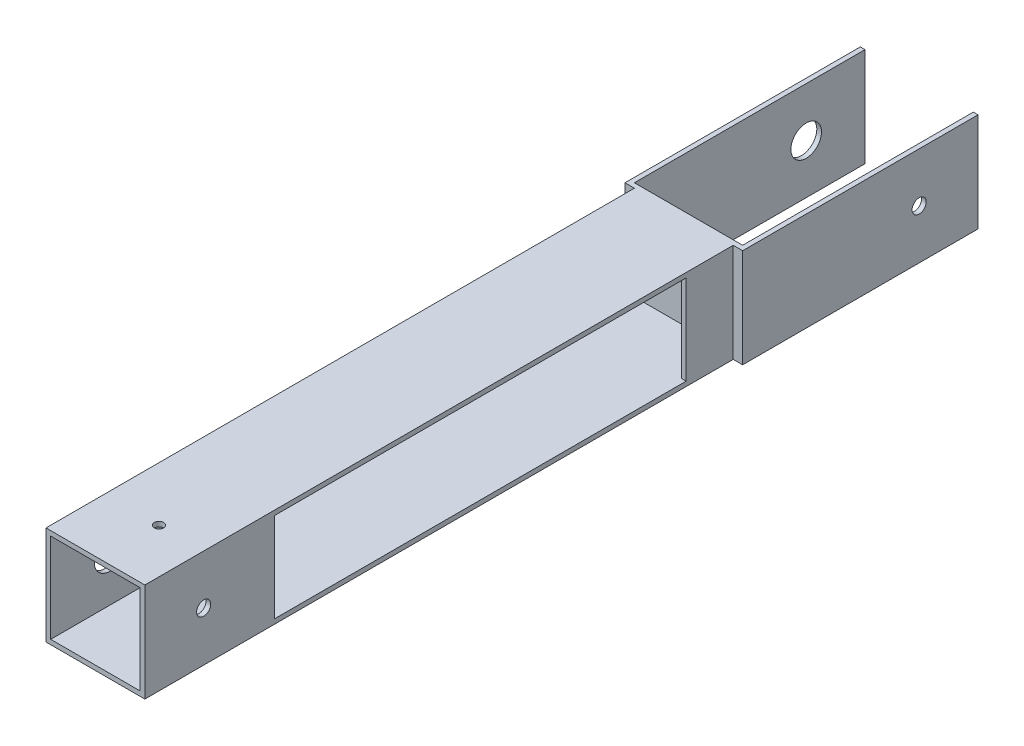
from build123d import *

# Parameters (mm, degrees)
SKETCH1_W           = 42
SKETCH1_H           = 42
SKETCH1_W_2         = 38
SKETCH1_H_2         = 38
BOSS_EXTRUDE1_DEPTH = 250
BOSS_EXTRUDE2_DEPTH = 21
CUT_EXTRUDE1_REACH  = 356.177
SKETCH3_R           = 6.5
CUT_EXTRUDE2_REACH  = 356.177
SKETCH4_R           = 3
SKETCH5_W           = 175
SKETCH5_H           = 38
CUT_EXTRUDE3_DEPTH  = 10
SKETCH6_R           = 2
CUT_EXTRUDE4_DEPTH  = 354.396378023


with BuildPart() as part:
    # Sketch1 → Boss-Extrude1 (new body)
    with BuildSketch(Plane.XY):
        Rectangle(SKETCH1_W, SKETCH1_H)
        Rectangle(SKETCH1_W_2, SKETCH1_H_2, mode=Mode.SUBTRACT)
    extrude(amount=-BOSS_EXTRUDE1_DEPTH)

    # Sketch2 → Boss-Extrude2 (add, symmetric)
    with BuildSketch(Plane(origin=(0, 0, 0), x_dir=(1, 0, 0), z_dir=(0, 1, 0))):
        Polygon((-25, 250), (-25, 350), (-23, 350), (-23, 252), (23, 252), (23, 350), (25, 350), (25, 250), align=None)
    extrude(amount=BOSS_EXTRUDE2_DEPTH, both=True)

    # Sketch3 → Cut-Extrude1 (cut, up to next)
    with BuildSketch(Plane.ZY.offset(25), mode=Mode.PRIVATE) as cut_extrude1_sk1:
        with Locations((-25, 0)):
            Circle(SKETCH3_R)
    cut_extrude1_tool1 = extrude(cut_extrude1_sk1.sketch, amount=-CUT_EXTRUDE1_REACH, mode=Mode.PRIVATE) & part.part
    # Sketch3 → Cut-Extrude1 (cut, up to next)
    with BuildSketch(Plane.ZY.offset(25), mode=Mode.PRIVATE) as cut_extrude1_sk2:
        with Locations((-325, 0)):
            Circle(SKETCH3_R)
    cut_extrude1_tool2 = extrude(cut_extrude1_sk2.sketch, amount=-CUT_EXTRUDE1_REACH, mode=Mode.PRIVATE) & part.part
    add(cut_extrude1_tool1.solids().sort_by_distance((-25, 0, -25))[0], mode=Mode.SUBTRACT)
    add(cut_extrude1_tool2.solids().sort_by_distance((-25, 0, -325))[0], mode=Mode.SUBTRACT)

    # Sketch4 → Cut-Extrude2 (cut, up to next)
    with BuildSketch(Plane(origin=(25, 0, 0), x_dir=(0, 0, -1), z_dir=(1, 0, 0)), mode=Mode.PRIVATE) as cut_extrude2_sk1:
        with Locations((325, 0)):
            Circle(SKETCH4_R)
    cut_extrude2_tool1 = extrude(cut_extrude2_sk1.sketch, amount=-CUT_EXTRUDE2_REACH, mode=Mode.PRIVATE) & part.part
    # Sketch4 → Cut-Extrude2 (cut, up to next)
    with BuildSketch(Plane(origin=(25, 0, 0), x_dir=(0, 0, -1), z_dir=(1, 0, 0)), mode=Mode.PRIVATE) as cut_extrude2_sk2:
        with Locations((25, 0)):
            Circle(SKETCH4_R)
    cut_extrude2_tool2 = extrude(cut_extrude2_sk2.sketch, amount=-CUT_EXTRUDE2_REACH, mode=Mode.PRIVATE) & part.part
    add(cut_extrude2_tool1.solids().sort_by_distance((25, 0, -325))[0], mode=Mode.SUBTRACT)
    add(cut_extrude2_tool2.solids().sort_by_distance((25, 0, -25))[0], mode=Mode.SUBTRACT)

    # Sketch5 → Cut-Extrude3 (cut)
    with BuildSketch(Plane(origin=(21, 0, 0), x_dir=(0, 0, -1), z_dir=(1, 0, 0))):
        with Locations((142.5, 0)):
            Rectangle(SKETCH5_W, SKETCH5_H)
    extrude(amount=-CUT_EXTRUDE3_DEPTH, mode=Mode.SUBTRACT)

    # Sketch6 → Cut-Extrude4 (cut, through all)
    with BuildSketch(Plane(origin=(0, 21, 0), x_dir=(1, 0, 0), z_dir=(0, 1, 0))):
        with Locations(Location((2, 25, 0), (0, 0, 270))):
            Circle(SKETCH6_R)
    extrude(amount=-CUT_EXTRUDE4_DEPTH, mode=Mode.SUBTRACT)


solid = part.part
